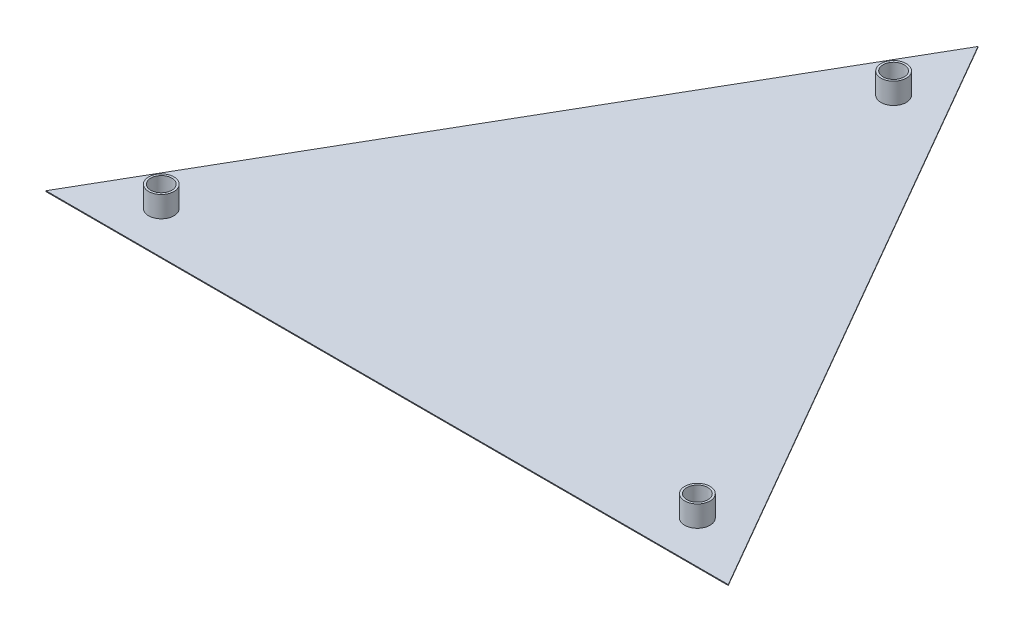
from build123d import *

# Parameters (mm, degrees)
SKETCH1_R             = 3
BOSS_EXTRUDE5_DEPTH   = 0.2
SKETCH1_21_R          = 3
SKETCH1_21_R_2        = 2.5
BOSS_EXTRUDE6_DEPTH   = 5
BOSS_EXTRUDE6_2_DEPTH = 5
BOSS_EXTRUDE6_3_DEPTH = 5


with BuildPart() as part:
    # Sketch1 → Boss-Extrude5 (new body)
    with BuildSketch(Plane(origin=(0, 0, 0), x_dir=(1, 0, 0), z_dir=(0, 1, 0))):
        Polygon((347.273609729, 23.609230825), (266.439108268, -116.428009241), (428.113670918, -116.417164681), align=None)
        with Locations((283.758521159, -106.426112565)):
            Circle(SKETCH1_R, mode=Mode.SUBTRACT)
        with Locations((410.793152563, -106.417182487)):
            Circle(SKETCH1_R, mode=Mode.SUBTRACT)
        with Locations((347.273609729, 3.609230825)):
            Circle(SKETCH1_R, mode=Mode.SUBTRACT)
    extrude(amount=-BOSS_EXTRUDE5_DEPTH)


with BuildPart() as body_2:
    # Sketch1<21> → Boss-Extrude6 (new body)
    with BuildSketch(Plane(origin=(0, 0, 0), x_dir=(1, 0, 0), z_dir=(0, 1, 0))):
        with Locations((347.273609729, 3.609230825)):
            Circle(SKETCH1_21_R)
        with Locations((347.273609729, 3.609230825)):
            Circle(SKETCH1_21_R_2, mode=Mode.SUBTRACT)
    extrude(amount=BOSS_EXTRUDE6_DEPTH)


with BuildPart() as body_3:
    # Sketch1<21> → Boss-Extrude6 2 (new body)
    with BuildSketch(Plane(origin=(0, 0, 0), x_dir=(1, 0, 0), z_dir=(0, 1, 0))):
        with Locations((410.793152563, -106.417182487)):
            Circle(SKETCH1_21_R)
        with Locations((410.793152563, -106.417182487)):
            Circle(SKETCH1_21_R_2, mode=Mode.SUBTRACT)
    extrude(amount=BOSS_EXTRUDE6_2_DEPTH)


with BuildPart() as body_4:
    # Sketch1<21> → Boss-Extrude6 3 (new body)
    with BuildSketch(Plane(origin=(0, 0, 0), x_dir=(1, 0, 0), z_dir=(0, 1, 0))):
        with Locations((283.758521159, -106.426112565)):
            Circle(SKETCH1_21_R)
        with Locations((283.758521159, -106.426112565)):
            Circle(SKETCH1_21_R_2, mode=Mode.SUBTRACT)
    extrude(amount=BOSS_EXTRUDE6_3_DEPTH)


solid = Compound([part.part, body_2.part, body_3.part, body_4.part])
